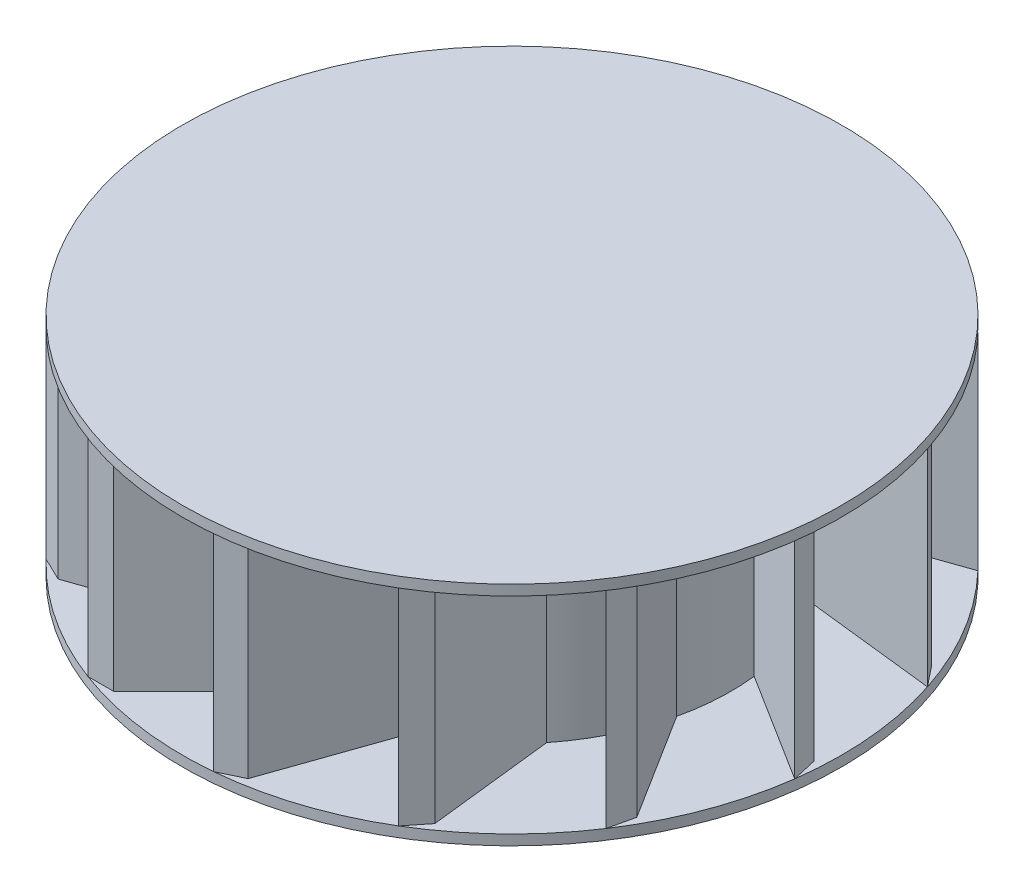
from build123d import *
from build123d.topology import SkipClean

# Parameters (mm, degrees)
SKETCH1_R           = 42.5
SKETCH1_R_2         = 3.75
BOSS_EXTRUDE1_DEPTH = 40
BOSS_EXTRUDE2_DEPTH = 40
SKETCH3_R           = 63.968087997
BOSS_EXTRUDE3_DEPTH = 2
BOSS_EXTRUDE4_START = 2
SKETCH4_R           = 63.968087997
BOSS_EXTRUDE4_DEPTH = 2
SKETCH6_R           = 3.75
CUT_EXTRUDE1_DEPTH  = 79


with BuildPart() as part:
    # Sketch1 → Boss-Extrude1 (new body)
    with BuildSketch(Plane(origin=(0, 0, 0), x_dir=(1, 0, 0), z_dir=(0, 1, 0))):
        with Locations(Location((0, 0, 0), (0, 0, 270))):
            Circle(SKETCH1_R)
        with Locations(Location((0, 0, 0), (0, 0, 270))):
            Circle(SKETCH1_R_2, mode=Mode.SUBTRACT)
    extrude(amount=BOSS_EXTRUDE1_DEPTH)

    # Sketch2 → Boss-Extrude2 (add)
    with BuildSketch(Plane.XZ):
        with BuildLine():
            Line((0, -42.5), (17.413037315, -59.913037315))
            Line((17.413037315, -59.913037315), (22.413037315, -59.913037315))
            Line((22.413037315, -59.913037315), (4.735367785, -42.235367785))
            ThreePointArc((4.735367785, -42.235367785), (2.3713782, -42.433790373), (0, -42.5))
        make_face()
        with BuildLine():
            Line((-18.440058912, -38.291176886), (-10.306688136, -61.535015142))
            Line((-10.306688136, -61.535015142), (-5.801843796, -63.704433837))
            Line((-5.801843796, -63.704433837), (-14.058820345, -40.107350579))
            ThreePointArc((-14.058820345, -40.107350579), (-16.2747937, -39.260426514), (-18.440058912, -38.291176886))
        make_face()
        with BuildLine():
            Line((-33.227838005, -26.498316579), (-35.985047598, -50.969228542))
            Line((-35.985047598, -50.969228542), (-32.867598589, -54.878385955))
            Line((-32.867598589, -54.878385955), (-30.068486686, -30.035580707))
            ThreePointArc((-30.068486686, -30.035580707), (-31.69754311, -28.311053685), (-33.227838005, -26.498316579))
        make_face()
        with BuildLine():
            Line((-41.434436268, -9.457139693), (-54.536127055, -30.308361133))
            Line((-54.536127055, -30.308361133), (-53.423522386, -35.183000694))
            Line((-53.423522386, -35.183000694), (-40.122720473, -14.014895714))
            ThreePointArc((-40.122720473, -14.014895714), (-40.842205363, -11.754329463), (-41.434436268, -9.457139693))
        make_face()
        with BuildLine():
            Line((-41.434436268, 9.457139693), (-62.285657708, -3.644551095))
            Line((-62.285657708, -3.644551095), (-63.398262378, -8.519190655))
            Line((-63.398262378, -8.519190655), (-42.230157397, 4.781611257))
            ThreePointArc((-42.230157397, 4.781611257), (-41.897567946, 7.130483868), (-41.434436268, 9.457139693))
        make_face()
        with BuildLine():
            Line((-33.227838005, 26.498316579), (-57.698749968, 23.741106986))
            Line((-57.698749968, 23.741106986), (-60.816198977, 19.831949574))
            Line((-60.816198977, 19.831949574), (-35.97339373, 22.631061476))
            ThreePointArc((-35.97339373, 22.631061476), (-34.654603358, 24.603017418), (-33.227838005, 26.498316579))
        make_face()
        with BuildLine():
            Line((-18.440058912, 38.291176886), (-41.683897168, 46.424547663))
            Line((-41.683897168, 46.424547663), (-46.188741508, 44.255128967))
            Line((-46.188741508, 44.255128967), (-22.59165825, 35.998152418))
            ThreePointArc((-22.59165825, 35.998152418), (-20.547869564, 37.202621633), (-18.440058912, 38.291176886))
        make_face()
        with BuildLine():
            Line((0, 42.5), (-17.413037315, 59.913037315))
            Line((-17.413037315, 59.913037315), (-22.413037315, 59.913037315))
            Line((-22.413037315, 59.913037315), (-4.735367785, 42.235367785))
            ThreePointArc((-4.735367785, 42.235367785), (-2.3713782, 42.433790373), (0, 42.5))
        make_face()
        with BuildLine():
            Line((18.440058912, 38.291176886), (10.306688136, 61.535015142))
            Line((10.306688136, 61.535015142), (5.801843796, 63.704433837))
            Line((5.801843796, 63.704433837), (14.058820345, 40.107350579))
            ThreePointArc((14.058820345, 40.107350579), (16.2747937, 39.260426514), (18.440058912, 38.291176886))
        make_face()
        with BuildLine():
            Line((33.227838005, 26.498316579), (35.985047598, 50.969228542))
            Line((35.985047598, 50.969228542), (32.867598589, 54.878385955))
            Line((32.867598589, 54.878385955), (30.068486686, 30.035580707))
            ThreePointArc((30.068486686, 30.035580707), (31.69754311, 28.311053685), (33.227838005, 26.498316579))
        make_face()
        with BuildLine():
            Line((41.434436268, 9.457139693), (54.536127055, 30.308361133))
            Line((54.536127055, 30.308361133), (53.423522386, 35.183000694))
            Line((53.423522386, 35.183000694), (40.122720473, 14.014895714))
            ThreePointArc((40.122720473, 14.014895714), (40.842205363, 11.754329463), (41.434436268, 9.457139693))
        make_face()
        with BuildLine():
            Line((41.434436268, -9.457139693), (62.285657708, 3.644551095))
            Line((62.285657708, 3.644551095), (63.398262378, 8.519190655))
            Line((63.398262378, 8.519190655), (42.230157397, -4.781611257))
            ThreePointArc((42.230157397, -4.781611257), (41.897567946, -7.130483868), (41.434436268, -9.457139693))
        make_face()
        with BuildLine():
            Line((33.227838005, -26.498316579), (57.698749968, -23.741106986))
            Line((57.698749968, -23.741106986), (60.816198977, -19.831949574))
            Line((60.816198977, -19.831949574), (35.97339373, -22.631061476))
            ThreePointArc((35.97339373, -22.631061476), (34.654603358, -24.603017418), (33.227838005, -26.498316579))
        make_face()
        with BuildLine():
            Line((18.440058912, -38.291176886), (41.683897168, -46.424547663))
            Line((41.683897168, -46.424547663), (46.188741508, -44.255128967))
            Line((46.188741508, -44.255128967), (22.59165825, -35.998152418))
            ThreePointArc((22.59165825, -35.998152418), (20.547869564, -37.202621633), (18.440058912, -38.291176886))
        make_face()
    extrude(amount=-BOSS_EXTRUDE2_DEPTH)

    # Sketch3 → Boss-Extrude3 (add)
    with BuildSketch(Plane.XZ):
        with Locations(Location((0, 0, 0), (0, 0, 84.796176724))):
            Circle(SKETCH3_R)
    extrude(amount=BOSS_EXTRUDE3_DEPTH)

    # Sketch6 → Cut-Extrude1 (cut)
    with SkipClean():  # the faces are left unmerged after this step: merging them gives an invalid solid
        with BuildSketch(Plane.XZ.offset(2)):
            with Locations(Location((0, 0, 0), (0, 0, 270))):
                Circle(SKETCH6_R)
        extrude(amount=-CUT_EXTRUDE1_DEPTH, mode=Mode.SUBTRACT)


with BuildPart() as body_2:
    # Sketch4 → Boss-Extrude4 (new body)
    with BuildSketch(Plane(origin=(0, 40, 0), x_dir=(1, 0, 0), z_dir=(0, 1, 0)).offset(BOSS_EXTRUDE4_START)):
        with Locations(Location((0, 0, 0), (0, 0, 270))):
            Circle(SKETCH4_R)
    extrude(amount=-BOSS_EXTRUDE4_DEPTH)


solid = Compound([part.part, body_2.part])
